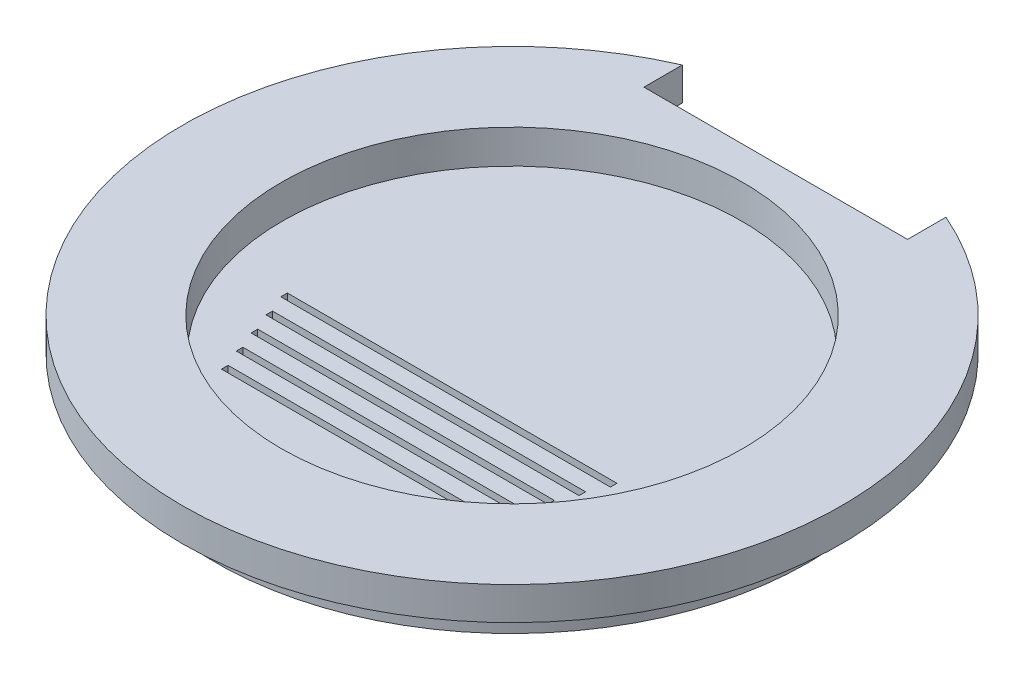
from build123d import *

# Parameters (mm, degrees)
BOSS_EXTRUDE1_DEPTH = 10
BOSS_EXTRUDE1_DRAFT = -0.5
BOSS_EXTRUDE2_DEPTH = 10
SKETCH3_W           = 100
SKETCH3_H           = 2
SKETCH3_W_2         = 95
SKETCH3_W_3         = 90
SKETCH3_W_4         = 85
SKETCH3_W_5         = 80
CUT_EXTRUDE1_DEPTH  = 143.828568571
SKETCH4_R           = 70
CUT_EXTRUDE2_DEPTH  = 10
CUT_EXTRUDE2_DRAFT  = -2


with BuildPart() as part:
    # Sketch1 → Boss-Extrude1 (with draft: the straight prism first)
    with BuildSketch(Plane(origin=(0, 0, 0), x_dir=(1, 0, 0), z_dir=(0, 1, 0))):
        with BuildLine():
            ThreePointArc((-50, 74.833147735), (0, -90), (50, 74.833147735))
            Line((50, 74.833147735), (50, 70))
            Line((50, 70), (-50, 70))
            Line((-50, 70), (-50, 74.833147735))
        make_face()
    extrude(amount=-BOSS_EXTRUDE1_DEPTH)
    # Boss-Extrude1: the draft: its side faces are tilted about the plane it starts from
    boss_extrude1_sides = [part.faces().sort_by_distance(p)[0] for p in [
        (50, -5, -72.416573868),
        (0, -5, -70),
        (-50, -5, -72.416573868),
        (0, -5, 90),
    ]]
    draft(boss_extrude1_sides, Plane(origin=(0, 0, 0), x_dir=(1, 0, 0), z_dir=(0, 1, 0)), BOSS_EXTRUDE1_DRAFT)

    # Sketch2 → Boss-Extrude2 (add)
    with BuildSketch(Plane(origin=(0, 0, 0), x_dir=(1, 0, 0), z_dir=(0, 1, 0))):
        with BuildLine():
            Line((-40, 91.651513899), (-40, 80))
            Line((-40, 80), (40, 80))
            Line((40, 80), (40, 91.651513899))
            ThreePointArc((40, 91.651513899), (0, -100), (-40, 91.651513899))
        make_face()
    extrude(amount=BOSS_EXTRUDE2_DEPTH)

    # Sketch3 → Cut-Extrude1 (cut, through all)
    with BuildSketch(Plane(origin=(0, 10, 0), x_dir=(1, 0, 0), z_dir=(0, 1, 0))):
        with Locations((0, -19.17330362)):
            Rectangle(SKETCH3_W, SKETCH3_H)
        with Locations((0, -26.17330362)):
            Rectangle(SKETCH3_W_2, SKETCH3_H)
        with Locations((0, -33.17330362)):
            Rectangle(SKETCH3_W_3, SKETCH3_H)
        with Locations((0, -40.17330362)):
            Rectangle(SKETCH3_W_4, SKETCH3_H)
        with Locations((0, -47.17330362)):
            Rectangle(SKETCH3_W_5, SKETCH3_H)
    extrude(amount=-CUT_EXTRUDE1_DEPTH, mode=Mode.SUBTRACT)


with BuildPart() as cut_extrude2_tool:
    # Sketch4 → Cut-Extrude2 (with draft: the straight prism first)
    with BuildSketch(Plane(origin=(0, 10, 0), x_dir=(1, 0, 0), z_dir=(0, 1, 0))):
        Circle(SKETCH4_R)
    extrude(amount=-CUT_EXTRUDE2_DEPTH)
    # Cut-Extrude2: the draft: its side faces are tilted about the plane it starts from
    cut_extrude2_sides = [cut_extrude2_tool.faces().sort_by_distance(p)[0] for p in [
        (-70, 5, 0),
    ]]
    draft(cut_extrude2_sides, Plane(origin=(0, 10, 0), x_dir=(1, 0, 0), z_dir=(0, 1, 0)), CUT_EXTRUDE2_DRAFT)


with BuildPart() as part_1:
    add(part.part)

    # Cut-Extrude2: cut by cut_extrude2_tool
    add(cut_extrude2_tool.part, mode=Mode.SUBTRACT)


solid = part_1.part
